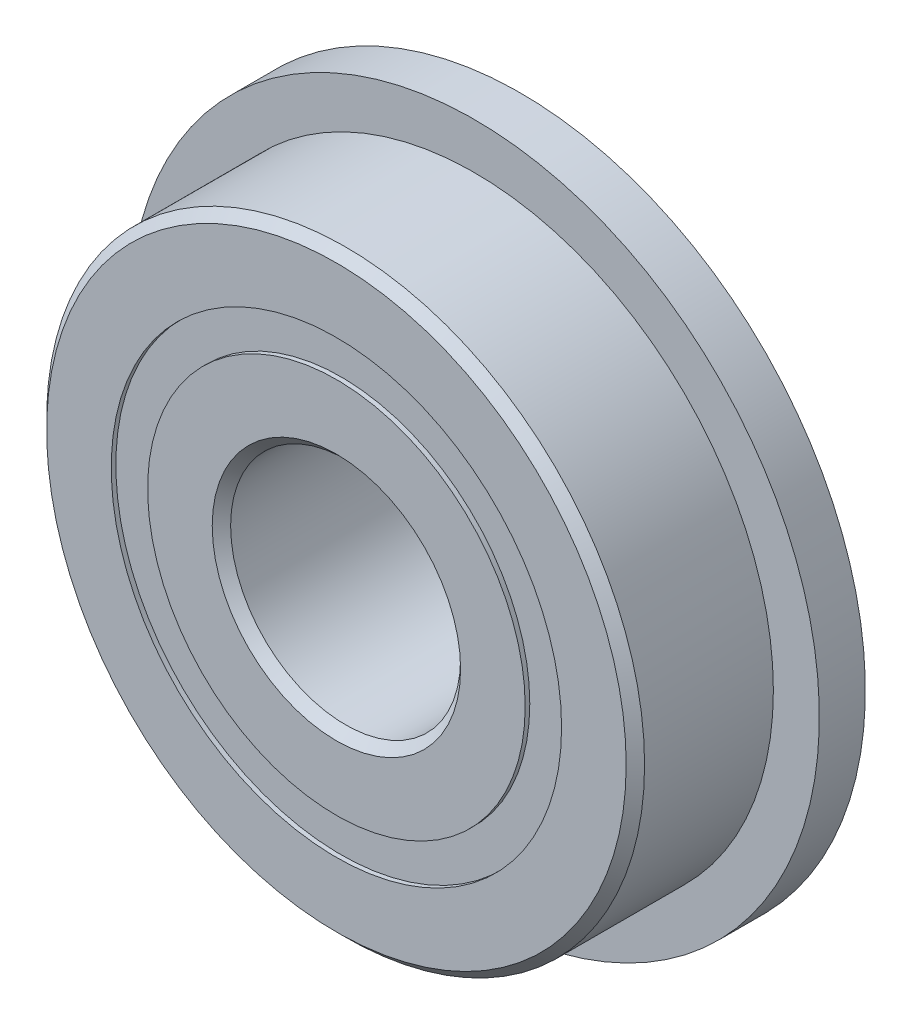
from build123d import *

# Parameters (mm, degrees)
SKETCH5_W = 0.927052779
SKETCH5_H = 0.791208792
SKETCH6_W = 1
SKETCH6_H = 2.604395604


with BuildPart() as part:
    # Sketch1 → Revolve1 (revolve)
    with BuildSketch(Plane(origin=(0, 0, 0), x_dir=(0, 0, -1), z_dir=(1, 0, 0)), mode=Mode.PRIVATE) as revolve1_sk:
        with BuildLine():
            Line((1.8, 6.5), (-1.8, 6.5))
            Line((-1.8, 6.5), (-2, 6.3))
            Line((-2, 6.3), (-2, 4.895604396))
            Line((-2, 4.895604396), (-0.888888889, 4.895604396))
            ThreePointArc((-0.888888889, 4.895604396), (0, 5.472947221), (0.888888889, 4.895604396))
            Line((0.888888889, 4.895604396), (2, 4.895604396))
            Line((2, 4.895604396), (2, 6.3))
            Line((2, 6.3), (1.8, 6.5))
        make_face()
    revolve(revolve1_sk.sketch.rotate(Axis((0, 0, 2), (0, 0, -1)), 90), axis=Axis((0, 0, 2), (0, 0, -1)))

    # Sketch6 → Revolve6 (revolve)
    with BuildSketch(Plane(origin=(0, 0, 0), x_dir=(0, 0, -1), z_dir=(1, 0, 0)), mode=Mode.PRIVATE) as revolve6_sk:
        with Locations((1.5, 6.197802198)):
            Rectangle(SKETCH6_W, SKETCH6_H)
    revolve(revolve6_sk.sketch.rotate(Axis((0, 0, -2), (0, 0, 1)), 270), axis=Axis((0, 0, -2), (0, 0, 1)))


with BuildPart() as body_2:
    # Sketch3 → Revolve3 (revolve)
    with BuildSketch(Plane(origin=(0, 0, 0), x_dir=(0, 0, -1), z_dir=(1, 0, 0)), mode=Mode.PRIVATE) as revolve3_sk:
        with BuildLine():
            Line((-2, 4.104395604), (-0.888888889, 4.104395604))
            ThreePointArc((-0.888888889, 4.104395604), (0, 3.527052779), (0.888888889, 4.104395604))
            Line((0.888888889, 4.104395604), (2, 4.104395604))
            Line((2, 4.104395604), (2, 2.7))
            Line((2, 2.7), (1.8, 2.5))
            Line((1.8, 2.5), (-1.8, 2.5))
            Line((-1.8, 2.5), (-2, 2.7))
            Line((-2, 2.7), (-2, 4.104395604))
        make_face()
    revolve(revolve3_sk.sketch.rotate(Axis((0, 0, 2), (0, 0, -1)), 90), axis=Axis((0, 0, 2), (0, 0, -1)))


with BuildPart() as body_3:
    # Sketch5 → Revolve5 (revolve)
    with BuildSketch(Plane(origin=(0, 0, 0), x_dir=(0, 0, -1), z_dir=(1, 0, 0)), mode=Mode.PRIVATE) as revolve5_sk:
        with Locations((-1.436473611, 4.5)):
            Rectangle(SKETCH5_W, SKETCH5_H)
        with Locations((1.436473611, 4.5)):
            Rectangle(SKETCH5_W, SKETCH5_H)
    revolve(revolve5_sk.sketch.rotate(Axis((0, 0, 2), (0, 0, -1)), 90), axis=Axis((0, 0, 2), (0, 0, -1)))


solid = Compound([part.part, body_2.part, body_3.part])
